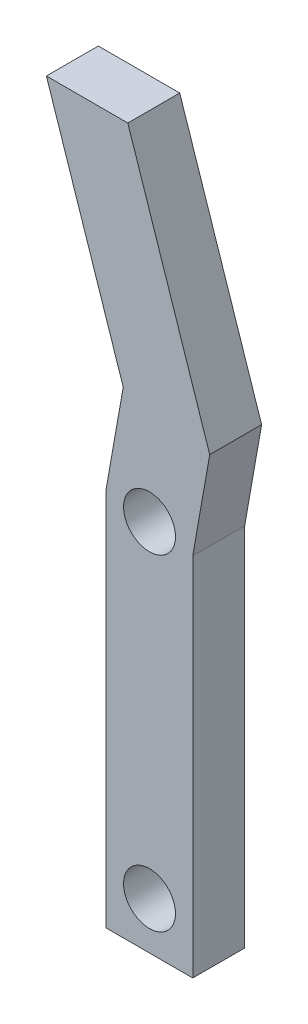
from build123d import *

# Parameters (mm, degrees)
ESQUISSE1_R        = 1.5
BOSS_EXTRU_1_DEPTH = 3


with BuildPart() as part:
    # Esquisse1 → Boss.-Extru.1 (new body)
    with BuildSketch(Plane.XY):
        Polygon((0, 22), (0.980378013, 27.567916897), (-3.460089883, 40.921177074), (1.247149775, 40.921177074), (5.980378013, 26.68753557), (5, 21.12753557), (5, 0), (0, 0), align=None)
        with Locations((2.5, 2.724444158)):
            Circle(ESQUISSE1_R, mode=Mode.SUBTRACT)
        with Locations((2.5, 21.584444158)):
            Circle(ESQUISSE1_R, mode=Mode.SUBTRACT)
    extrude(amount=BOSS_EXTRU_1_DEPTH)


solid = part.part
